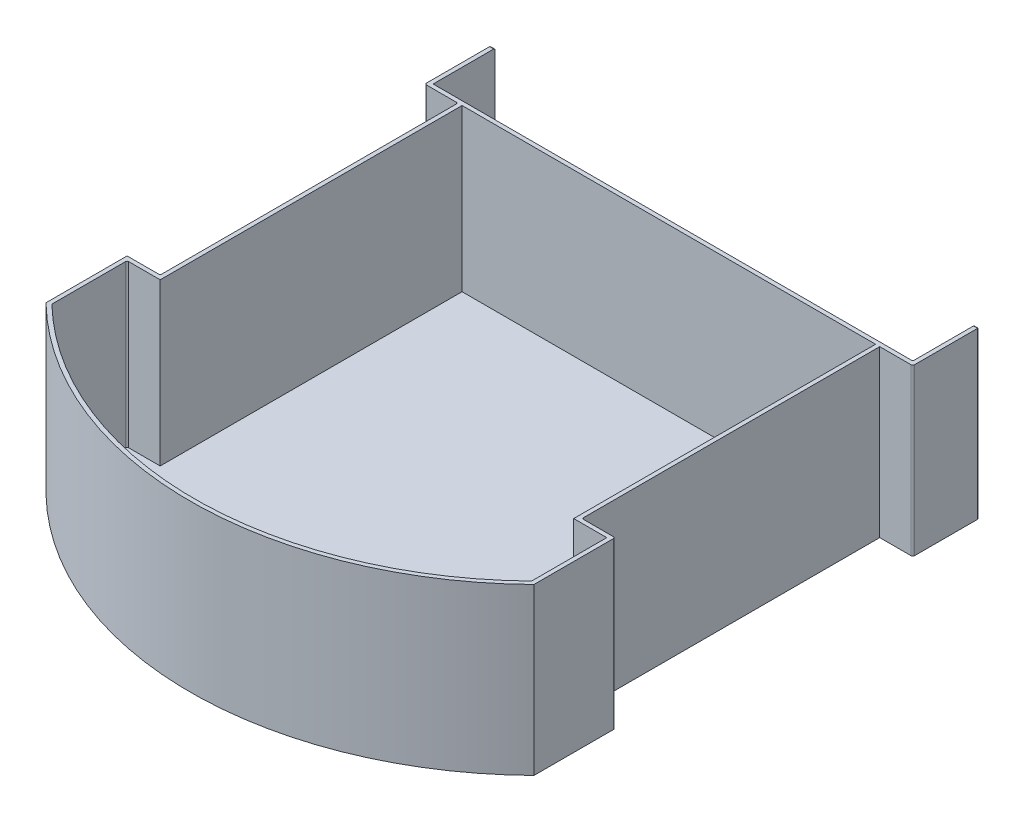
from build123d import *

# Parameters (mm, degrees)
BOSS_EXTRUDE1_DEPTH = 100
FILLET1_R           = 1
BOSS_EXTRUDE2_START = 2.5
BOSS_EXTRUDE2_DEPTH = 2.5


with BuildPart() as part:
    # Sketch1 → Boss-Extrude1 (new body)
    with BuildSketch(Plane(origin=(0, 0, 0), x_dir=(1, 0, 0), z_dir=(0, 1, 0))):
        with BuildLine():
            Line((-147.5, 118.765325103), (-145, 118.765325103))
            Line((-145, 118.765325103), (-145, 81.265325103))
            Line((-145, 81.265325103), (-125, 81.265325103))
            Line((-125, 81.265325103), (125, 81.265325103))
            Line((125, 81.265325103), (145, 81.265325103))
            Line((145, 81.265325103), (145, 118.765325103))
            Line((145, 118.765325103), (147.5, 118.765325103))
            Line((147.5, 118.765325103), (147.5, 78.765325103))
            Line((147.5, 78.765325103), (127.5, 78.765325103))
            Line((127.5, 78.765325103), (127.5, -101.234674897))
            Line((127.5, -101.234674897), (147.5, -101.234674897))
            Line((147.5, -101.234674897), (147.5, -150.264700033))
            ThreePointArc((147.5, -150.264700033), (0, -210.560514048), (-147.5, -150.264700033))
            Line((-147.5, -150.264700033), (-147.5, -101.234674897))
            Line((-147.5, -101.234674897), (-127.5, -101.234674897))
            Line((-127.5, -101.234674897), (-127.5, 78.765325103))
            Line((-127.5, 78.765325103), (-147.5, 78.765325103))
            Line((-147.5, 78.765325103), (-147.5, 118.765325103))
        make_face()
        with BuildLine():
            Line((145, -149.211854441), (145, -103.734674897))
            Line((145, -103.734674897), (125, -103.734674897))
            Line((125, -103.734674897), (125, 78.765325103))
            Line((125, 78.765325103), (-125, 78.765325103))
            Line((-125, 78.765325103), (-125, -103.734674897))
            Line((-125, -103.734674897), (-145, -103.734674897))
            Line((-145, -103.734674897), (-145, -149.211854441))
            ThreePointArc((-145, -149.211854441), (0, -208.060514048), (145, -149.211854441))
        make_face(mode=Mode.SUBTRACT)
    extrude(amount=BOSS_EXTRUDE1_DEPTH)

    # Fillet1
    fillet1_edges = [part.edges().sort_by_distance(p)[0] for p in [
        (-146.25, 0, -118.765325103),
        (146.25, 100, -118.765325103),
        (146.25, 0, -118.765325103),
        (147.5, 50, 101.234674897),
        (-147.5, 50, 150.264700033),
        (-127.5, 50, 101.234674897),
        (-127.5, 50, -78.765325103),
        (-147.5, 50, -78.765325103),
        (145, 50, -81.265325103),
        (145, 50, -118.765325103),
        (147.5, 50, -118.765325103),
        (147.5, 50, -78.765325103),
        (127.5, 50, 101.234674897),
        (-146.25, 100, -118.765325103),
        (-145, 50, 103.734674897),
        (145, 50, 149.211854441),
    ]]
    fillet(fillet1_edges, radius=FILLET1_R)

    # Sketch4 → Boss-Extrude2 (add)
    with BuildSketch(Plane(origin=(0, 0, 0), x_dir=(1, 0, 0), z_dir=(0, 1, 0)).offset(BOSS_EXTRUDE2_START)):
        with BuildLine():
            Line((147.5, 79.765325103), (147.5, 117.765325103))
            Line((147.5, 117.765325103), (145, 117.765325103))
            Line((145, 117.765325103), (145, 82.265325103))
            ThreePointArc((145, 82.265325103), (144.707106781, 81.558218322), (144, 81.265325103))
            Line((144, 81.265325103), (-145, 81.265325103))
            Line((-145, 81.265325103), (-145, 117.765325103))
            Line((-145, 117.765325103), (-147.5, 117.765325103))
            Line((-147.5, 117.765325103), (-147.5, 79.765325103))
            ThreePointArc((-147.5, 79.765325103), (-147.207106781, 79.058218322), (-146.5, 78.765325103))
            Line((-146.5, 78.765325103), (-128.5, 78.765325103))
            ThreePointArc((-128.5, 78.765325103), (-127.792893219, 78.472431884), (-127.5, 77.765325103))
            Line((-127.5, 77.765325103), (-127.5, -100.234674897))
            ThreePointArc((-127.5, -100.234674897), (-127.792893219, -100.941781678), (-128.5, -101.234674897))
            Line((-128.5, -101.234674897), (-147.5, -101.234674897))
            Line((-147.5, -101.234674897), (-147.5, -149.844449507))
            ThreePointArc((-147.5, -149.844449507), (-147.421705506, -150.232339904), (-147.19908208, -150.559490936))
            ThreePointArc((-147.19908208, -150.559490936), (0.210626014, -210.560408702), (147.5, -150.264700033))
            Line((147.5, -150.264700033), (147.5, -102.234674897))
            ThreePointArc((147.5, -102.234674897), (147.207106781, -101.527568116), (146.5, -101.234674897))
            Line((146.5, -101.234674897), (128.5, -101.234674897))
            ThreePointArc((128.5, -101.234674897), (127.792893219, -100.941781678), (127.5, -100.234674897))
            Line((127.5, -100.234674897), (127.5, 78.765325103))
            Line((127.5, 78.765325103), (146.5, 78.765325103))
            ThreePointArc((146.5, 78.765325103), (147.207106781, 79.058218322), (147.5, 79.765325103))
        make_face()
    extrude(amount=-BOSS_EXTRUDE2_DEPTH)


solid = part.part
